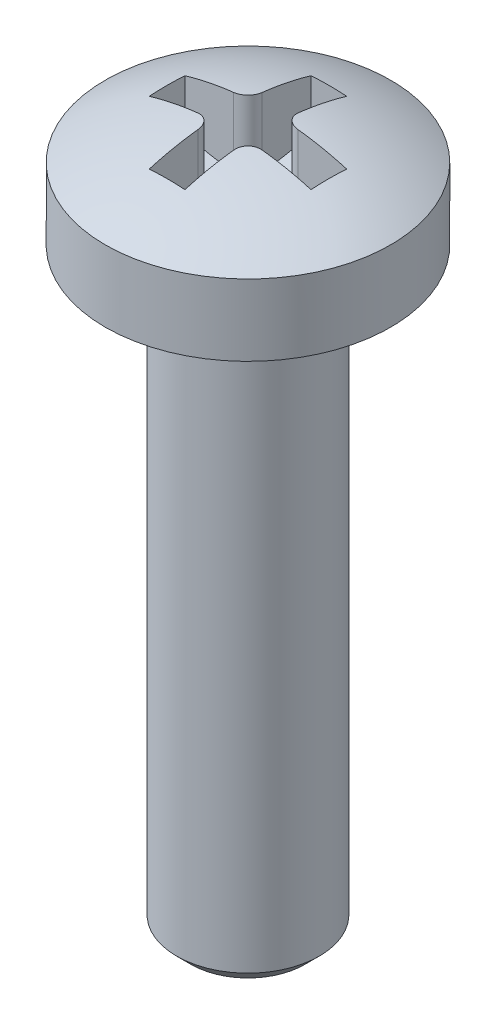
from build123d import *

# Parameters (mm, degrees)
CUT_EXTRUDE1_REACH      = 48.401
CUT_EXTRUDE1_END_RADIUS = 12.75
CUT_EXTRUDE1_START      = 20
FILLET1_R               = 0.6
CHAMFER1_SIZE           = 0.6


with BuildPart() as part:
    # Sketch1 → Revolve1 (revolve)
    with BuildSketch(Plane.XY, mode=Mode.PRIVATE) as revolve1_sk:
        with BuildLine():
            Line((0, 0), (0, 4.6))
            ThreePointArc((0, 4.6), (3.104834939, 4.193131022), (6, 3))
            Line((6, 3), (6, 0))
            Line((6, 0), (3, 0))
            Line((3, 0), (3, -25))
            Line((3, -25), (0, -25))
            Line((0, -25), (0, 0))
        make_face()
    revolve(revolve1_sk.sketch.rotate(Axis((0, 4.6, 0), (0, -1, 0)), 90), axis=Axis((0, 4.6, 0), (0, -1, 0)))

    # Cut-Extrude1: up to this sphere (the profile starts inside it)
    cut_extrude1_end = Location((0, 14.25, 0)) * Sphere(CUT_EXTRUDE1_END_RADIUS, mode=Mode.PRIVATE)
    # Sketch4 → Cut-Extrude1 (cut, up to the surface)
    with BuildSketch(Plane(origin=(0, 0, 0), x_dir=(1, 0, 0), z_dir=(0, 1, 0)).offset(CUT_EXTRUDE1_START), mode=Mode.PRIVATE) as cut_extrude1_sk1:
        Polygon((-0.75, -0.75), (-0.75, -3.4), (0.75, -3.4), (0.75, -0.75), (3.4, -0.75), (3.4, 0.75), (0.75, 0.75), (0.75, 3.4), (-0.75, 3.4), (-0.75, 0.75), (-3.4, 0.75), (-3.4, -0.75), align=None)
    cut_extrude1_tool1 = extrude(cut_extrude1_sk1.sketch, amount=-CUT_EXTRUDE1_REACH, mode=Mode.PRIVATE) & cut_extrude1_end
    add(cut_extrude1_tool1.solids().sort_by_distance((0, 20, 0))[0], mode=Mode.SUBTRACT)

    # Fillet1
    fillet1_edges = [part.edges().sort_by_distance(p)[0] for p in [
        (0.75, 3.048711486, 0.75),
        (-0.75, 3.048711486, 0.75),
        (-0.75, 3.048711486, -0.75),
        (0.75, 3.048711486, -0.75),
    ]]
    fillet(fillet1_edges, radius=FILLET1_R)

    # Chamfer1
    chamfer1_edges = [part.edges().sort_by_distance(p)[0] for p in [
        (0, -25, -3),
    ]]
    chamfer(chamfer1_edges, length=CHAMFER1_SIZE)


solid = part.part
